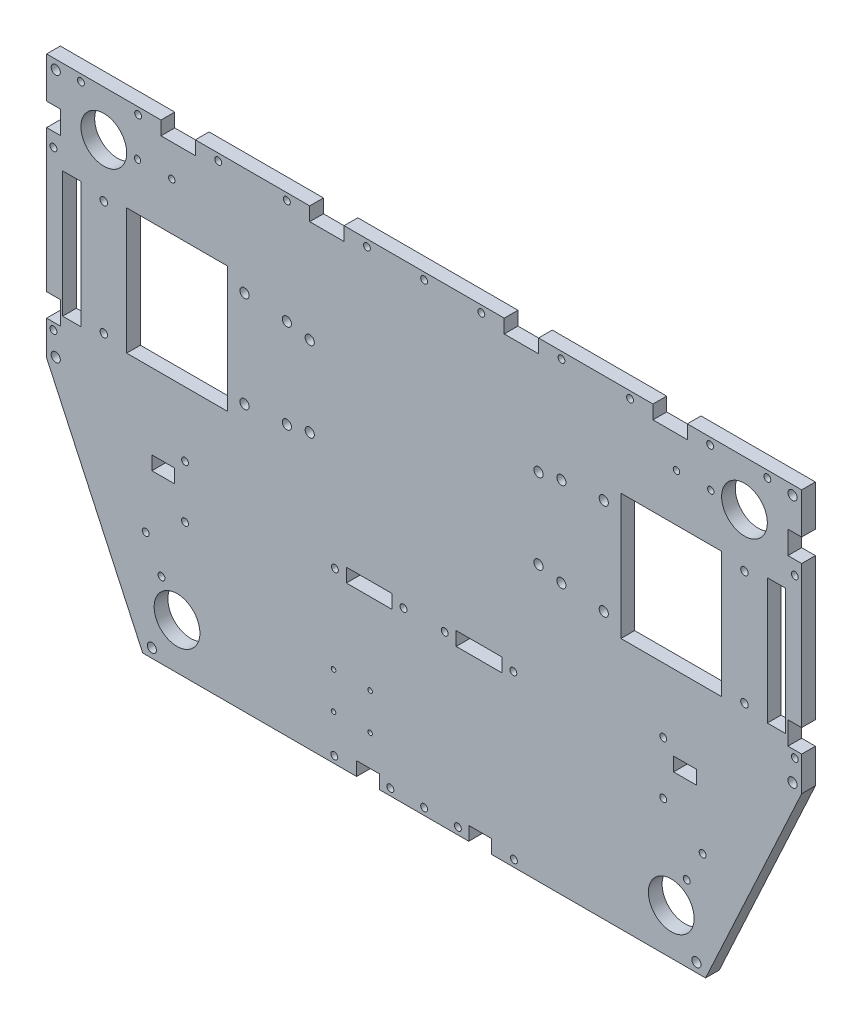
from build123d import *

# Parameters (mm, degrees)
ESQUISSE1_R             = 1
BOSS_EXTRU_1_DEPTH      = 6
ESQUISSE2_R             = 10
ESQUISSE2_R_2           = 2
ESQUISSE2_R_3           = 1.4
ESQUISSE2_R_4           = 1.5
ESQUISSE2_W             = 8
ESQUISSE2_H             = 55
ESQUISSE2_W_2           = 44
ENL_V_MAT_EXTRU_1_DEPTH = 6
ESQUISSE3_W             = 6
ESQUISSE3_H             = 10
ESQUISSE3_W_2           = 10
ESQUISSE3_H_2           = 6
ESQUISSE3_W_3           = 15
ENL_V_MAT_EXTRU_2_DEPTH = 6
ESQUISSE4_R             = 1.5
ENL_V_MAT_EXTRU_3_DEPTH = 6
ESQUISSE5_W             = 10
ESQUISSE5_H             = 6
ESQUISSE5_W_2           = 20
ENL_V_MAT_EXTRU_4_DEPTH = 6
ESQUISSE6_R             = 1.65
ESQUISSE6_R_2           = 1.5
ESQUISSE6_R_3           = 2
ENL_V_MAT_EXTRU_5_DEPTH = 6


with BuildPart() as part:
    # Esquisse1 → Boss.-Extru.1 (new body)
    with BuildSketch(Plane.XY):
        Polygon((-165, 96.73), (165, 96.73), (165, -18.27), (123, -109.022410436), (-123, -109.022410436), (-165, -18.27), align=None)
        with Locations((-23.6, -89.522410436)):
            Circle(ESQUISSE1_R, mode=Mode.SUBTRACT)
        with Locations((-23.6, -73.522410436)):
            Circle(ESQUISSE1_R, mode=Mode.SUBTRACT)
        with Locations((-39.6, -89.522410436)):
            Circle(ESQUISSE1_R, mode=Mode.SUBTRACT)
        with Locations((-39.6, -73.522410436)):
            Circle(ESQUISSE1_R, mode=Mode.SUBTRACT)
    extrude(amount=BOSS_EXTRU_1_DEPTH)

    # Esquisse2 → Enlèv. mat.-Extru.1 (cut)
    with BuildSketch(Plane.XY.offset(6)):
        with Locations((140, 76.73)):
            Circle(ESQUISSE2_R)
        with Locations((108, -89.022410436)):
            Circle(ESQUISSE2_R)
        with Locations(Location((-140, 76.73, 0), (0, 0, 180))):
            Circle(ESQUISSE2_R)
        with Locations(Location((-108, -89.022410436, 0), (0, 0, 180))):
            Circle(ESQUISSE2_R)
        with Locations((161, -16.022410436)):
            Circle(ESQUISSE2_R_2)
        with Locations((119, -105.022410436)):
            Circle(ESQUISSE2_R_2)
        with Locations((161, 92.73)):
            Circle(ESQUISSE2_R_2)
        with Locations(Location((-161, 92.73, 0), (0, 0, 180))):
            Circle(ESQUISSE2_R_2)
        with Locations(Location((-161, -16.022410436, 0), (0, 0, 180))):
            Circle(ESQUISSE2_R_2)
        with Locations(Location((-119, -105.022410436, 0), (0, 0, 180))):
            Circle(ESQUISSE2_R_2)
        with Locations((125.27, 76.73)):
            Circle(ESQUISSE2_R_3)
        with Locations((110.27, 76.73)):
            Circle(ESQUISSE2_R_3)
        with Locations((114.7893454, -75.950391119)):
            Circle(ESQUISSE2_R_4)
        with Locations((121.703139086, -62.638762485)):
            Circle(ESQUISSE2_R_4)
        with Locations(Location((-110.27, 76.73, 0), (0, 0, 180))):
            Circle(ESQUISSE2_R_3)
        with Locations(Location((-125.27, 76.73, 0), (0, 0, 180))):
            Circle(ESQUISSE2_R_3)
        with Locations(Location((-121.703139086, -62.638762485, 0), (0, 0, 180))):
            Circle(ESQUISSE2_R_4)
        with Locations(Location((-114.7893454, -75.950391119, 0), (0, 0, 180))):
            Circle(ESQUISSE2_R_4)
        with Locations((-154, 28.477589564)):
            Rectangle(ESQUISSE2_W, ESQUISSE2_H)
        with Locations((-108, 28.477589564)):
            Rectangle(ESQUISSE2_W_2, ESQUISSE2_H)
        with Locations((108, 28.477589564)):
            Rectangle(ESQUISSE2_W_2, ESQUISSE2_H)
        with Locations((154, 28.477589564)):
            Rectangle(ESQUISSE2_W, ESQUISSE2_H)
    extrude(amount=-ENL_V_MAT_EXTRU_1_DEPTH, mode=Mode.SUBTRACT)

    # Esquisse3 → Enlèv. mat.-Extru.2 (cut)
    with BuildSketch(Plane(origin=(0, 0, 0), x_dir=(-1, 0, 0), z_dir=(0, 0, -1))):
        with Locations((162, 1.73)):
            Rectangle(ESQUISSE3_W, ESQUISSE3_H)
        with Locations((162, 73.852589564)):
            Rectangle(ESQUISSE3_W, ESQUISSE3_H)
        with Locations((24.5, -106.022410436)):
            Rectangle(ESQUISSE3_W_2, ESQUISSE3_H_2)
        with Locations((-24.5, -106.022410436)):
            Rectangle(ESQUISSE3_W_2, ESQUISSE3_H_2)
        with Locations((-162, 73.852589564)):
            Rectangle(ESQUISSE3_W, ESQUISSE3_H)
        with Locations((-162, 1.73)):
            Rectangle(ESQUISSE3_W, ESQUISSE3_H)
        with Locations((107.5, 93.73)):
            Rectangle(ESQUISSE3_W_3, ESQUISSE3_H_2)
        with Locations((-42.5, 93.73)):
            Rectangle(ESQUISSE3_W_3, ESQUISSE3_H_2)
        with Locations((42.5, 93.73)):
            Rectangle(ESQUISSE3_W_3, ESQUISSE3_H_2)
        with Locations((-107.5, 93.73)):
            Rectangle(ESQUISSE3_W_3, ESQUISSE3_H_2)
    extrude(amount=-ENL_V_MAT_EXTRU_2_DEPTH, mode=Mode.SUBTRACT)

    # Esquisse4 → Enlèv. mat.-Extru.3 (cut)
    with BuildSketch(Plane(origin=(0, 0, 0), x_dir=(-1, 0, 0), z_dir=(0, 0, -1))):
        with Locations((162, -6.27)):
            Circle(ESQUISSE4_R)
        with Locations((0, -106.022410436)):
            Circle(ESQUISSE4_R)
        with Locations((162, 62.852589564)):
            Circle(ESQUISSE4_R)
        with Locations((0, 93.73)):
            Circle(ESQUISSE4_R)
        with Locations(Location((-39.25, -106.022410436, 0), (0, 0, 180))):
            Circle(ESQUISSE4_R)
        with Locations(Location((-14.75, -106.022410436, 0), (0, 0, 180))):
            Circle(ESQUISSE4_R)
        with Locations((14.75, -106.022410436)):
            Circle(ESQUISSE4_R)
        with Locations((39.25, -106.022410436)):
            Circle(ESQUISSE4_R)
        with Locations((150, 93.73)):
            Circle(ESQUISSE4_R)
        with Locations((125, 93.73)):
            Circle(ESQUISSE4_R)
        with Locations((90, 93.73)):
            Circle(ESQUISSE4_R)
        with Locations(Location((-25, 93.73, 0), (0, 0, 180))):
            Circle(ESQUISSE4_R)
        with Locations((60, 93.73)):
            Circle(ESQUISSE4_R)
        with Locations((25, 93.73)):
            Circle(ESQUISSE4_R)
        with Locations(Location((-60, 93.73, 0), (0, 0, 180))):
            Circle(ESQUISSE4_R)
        with Locations(Location((-90, 93.73, 0), (0, 0, 180))):
            Circle(ESQUISSE4_R)
        with Locations(Location((-125, 93.73, 0), (0, 0, 180))):
            Circle(ESQUISSE4_R)
        with Locations(Location((-150, 93.73, 0), (0, 0, 180))):
            Circle(ESQUISSE4_R)
        with Locations(Location((-162, 62.852589564, 0), (0, 0, 180))):
            Circle(ESQUISSE4_R)
        with Locations(Location((-162, -6.27, 0), (0, 0, 180))):
            Circle(ESQUISSE4_R)
    extrude(amount=-ENL_V_MAT_EXTRU_3_DEPTH, mode=Mode.SUBTRACT)

    # Esquisse5 → Enlèv. mat.-Extru.4 (cut)
    with BuildSketch(Plane(origin=(0, 0, 0), x_dir=(-1, 0, 0), z_dir=(0, 0, -1))):
        with Locations((114, -35.022410436)):
            Rectangle(ESQUISSE5_W, ESQUISSE5_H)
        with Locations((24, -35.022410436)):
            Rectangle(ESQUISSE5_W_2, ESQUISSE5_H)
        with Locations((-24, -35.022410436)):
            Rectangle(ESQUISSE5_W_2, ESQUISSE5_H)
        with Locations((-114, -35.022410436)):
            Rectangle(ESQUISSE5_W, ESQUISSE5_H)
    extrude(amount=-ENL_V_MAT_EXTRU_4_DEPTH, mode=Mode.SUBTRACT)

    # Esquisse6 → Enlèv. mat.-Extru.5 (cut)
    with BuildSketch(Plane(origin=(0, 0, 0), x_dir=(-1, 0, 0), z_dir=(0, 0, -1))):
        with Locations((-140, 3.477589564)):
            Circle(ESQUISSE6_R)
        with Locations((-140, 53.477589564)):
            Circle(ESQUISSE6_R)
        with Locations(Location((140, 53.477589564, 0), (0, 0, 180))):
            Circle(ESQUISSE6_R)
        with Locations(Location((140, 3.477589564, 0), (0, 0, 180))):
            Circle(ESQUISSE6_R)
        with Locations(Location((-39, -35.022410436, 0), (0, 0, 180))):
            Circle(ESQUISSE6_R_2)
        with Locations((9, -35.022410436)):
            Circle(ESQUISSE6_R_2)
        with Locations((39, -35.022410436)):
            Circle(ESQUISSE6_R_2)
        with Locations(Location((-9, -35.022410436, 0), (0, 0, 180))):
            Circle(ESQUISSE6_R_2)
        with Locations((-78.5, 49.477589564)):
            Circle(ESQUISSE6_R_3)
        with Locations((-78.5, 7.477589564)):
            Circle(ESQUISSE6_R_3)
        with Locations((-60, 47.977589564)):
            Circle(ESQUISSE6_R_3)
        with Locations((-60, 8.977894939)):
            Circle(ESQUISSE6_R_3)
        with Locations((60, 8.977894939)):
            Circle(ESQUISSE6_R_3)
        with Locations((60, 47.977589564)):
            Circle(ESQUISSE6_R_3)
        with Locations((-50, 45.977589564)):
            Circle(ESQUISSE6_R_3)
        with Locations((50, 45.977589564)):
            Circle(ESQUISSE6_R_3)
        with Locations((50, 10.977589564)):
            Circle(ESQUISSE6_R_3)
        with Locations((-50, 10.977589564)):
            Circle(ESQUISSE6_R_3)
        with Locations(Location((78.5, 7.477589564, 0), (0, 0, 180))):
            Circle(ESQUISSE6_R_3)
        with Locations(Location((78.5, 49.477589564, 0), (0, 0, 180))):
            Circle(ESQUISSE6_R_3)
        with Locations((104.5, -27.222410436)):
            Circle(ESQUISSE6_R_2)
        with Locations((104.5, -50.222410436)):
            Circle(ESQUISSE6_R_2)
        with Locations(Location((-104.5, -50.222410436, 0), (0, 0, 180))):
            Circle(ESQUISSE6_R_2)
        with Locations(Location((-104.5, -27.222410436, 0), (0, 0, 180))):
            Circle(ESQUISSE6_R_2)
    extrude(amount=-ENL_V_MAT_EXTRU_5_DEPTH, mode=Mode.SUBTRACT)


solid = part.part
